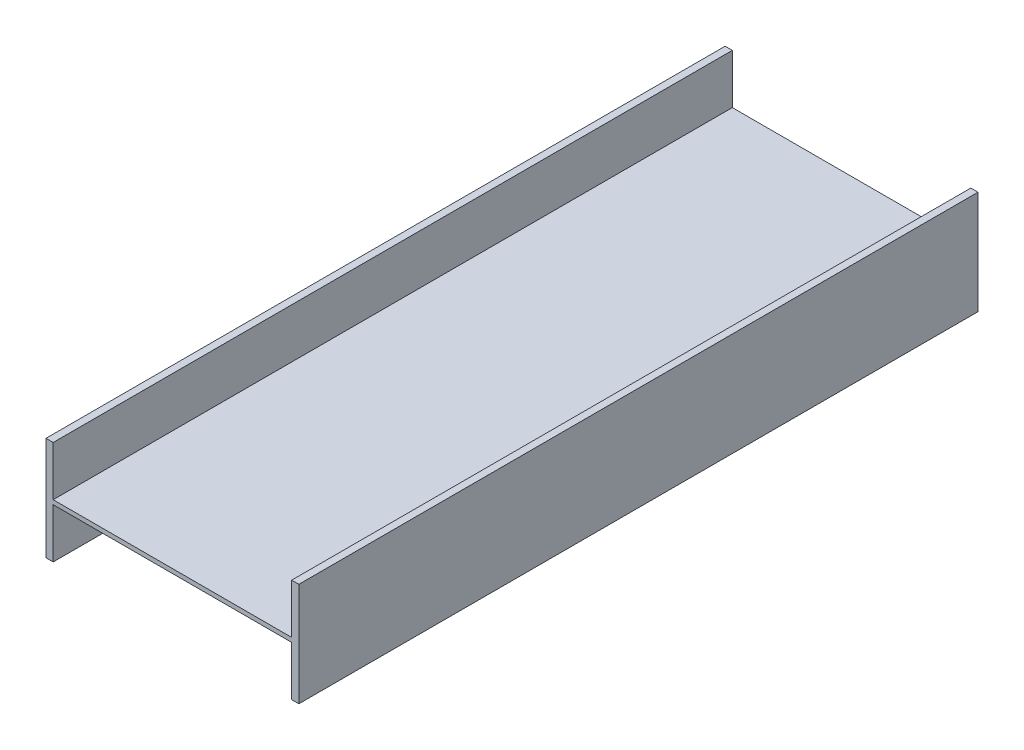
from build123d import *

# Parameters (mm, degrees)
SKETCH1_W           = 1053.5
SKETCH1_H           = 19.05
BOSS_EXTRUDE1_DEPTH = 3000


with BuildPart() as part:
    # Sketch1 → Boss-Extrude1 (new body)
    with BuildSketch(Plane.XY):
        Polygon((-526.75, -228.6), (-526.75, -9.525), (-526.75, 9.525), (-526.75, 228.6), (-558.5, 228.6), (-558.5, -228.6), align=None)
        Rectangle(SKETCH1_W, SKETCH1_H)
        Polygon((526.75, 9.525), (526.75, -9.525), (526.75, -228.6), (558.5, -228.6), (558.5, 228.6), (526.75, 228.6), align=None)
    extrude(amount=BOSS_EXTRUDE1_DEPTH)


solid = part.part
